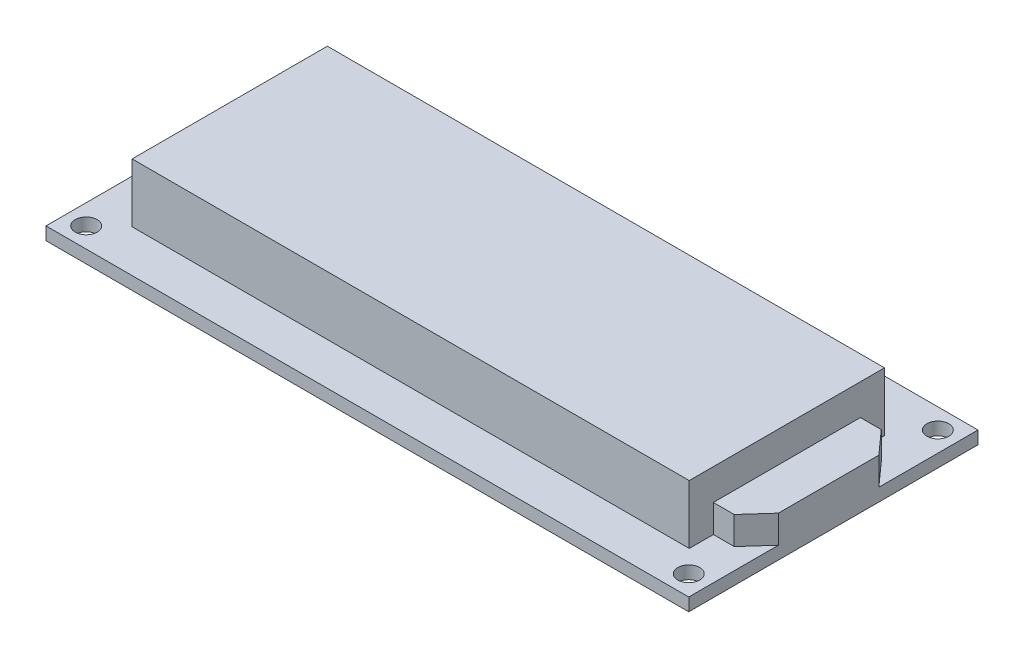
from build123d import *

# Parameters (mm, degrees)
SKETCH1_W               = 80
SKETCH1_H               = 36
BOSS_EXTRUDE1_DEPTH     = 1.6
SKETCH2_W               = 69.34
SKETCH2_H               = 24.3
BOSS_EXTRUDE2_DEPTH     = 7.32
BOSS_EXTRUDE3_DEPTH     = 3.46
CUT_EXTRUDE1_DEPTH      = 45.470016865
CUT_EXTRUDE1_DEPTH_BACK = 45.470016865
SKETCH4_R               = 1.36


with BuildPart() as part:
    # Sketch1 → Boss-Extrude1 (new body)
    with BuildSketch(Plane(origin=(0, 0, 0), x_dir=(1, 0, 0), z_dir=(0, 1, 0))):
        Rectangle(SKETCH1_W, SKETCH1_H)
    extrude(amount=BOSS_EXTRUDE1_DEPTH)

    # Sketch2 → Boss-Extrude2 (add)
    with BuildSketch(Plane(origin=(0, 1.6, 0), x_dir=(1, 0, 0), z_dir=(0, 1, 0))):
        with Locations((0.13, -0.59)):
            Rectangle(SKETCH2_W, SKETCH2_H)
    extrude(amount=BOSS_EXTRUDE2_DEPTH)

    # Sketch3 → Boss-Extrude3 (add)
    with BuildSketch(Plane(origin=(0, 1.6, 0), x_dir=(1, 0, 0), z_dir=(0, 1, 0))):
        Polygon((40, 5.66), (40, -6.84), (37.4, -9.74), (34.8, -9.74), (34.8, 8.56), (37.4, 8.56), align=None)
    extrude(amount=BOSS_EXTRUDE3_DEPTH)

    # Sketch4 → Cut-Extrude1 (cut, two sides: drawn at the far end of the back side and taken through both)
    with BuildSketch(Plane(origin=(0, 1.6, 0), x_dir=(1, 0, 0), z_dir=(0, 1, 0)).offset(-CUT_EXTRUDE1_DEPTH_BACK)):
        with Locations(Location((-37.5, 15.5, 0), (0, 0, 270))):
            Circle(SKETCH4_R)
        with Locations(Location((-37.5, -15.5, 0), (0, 0, 270))):
            Circle(SKETCH4_R)
        with Locations(Location((37.5, -15.5, 0), (0, 0, 270))):
            Circle(SKETCH4_R)
        with Locations(Location((37.5, 15.5, 0), (0, 0, 270))):
            Circle(SKETCH4_R)
    extrude(amount=CUT_EXTRUDE1_DEPTH + CUT_EXTRUDE1_DEPTH_BACK, mode=Mode.SUBTRACT)


solid = part.part
